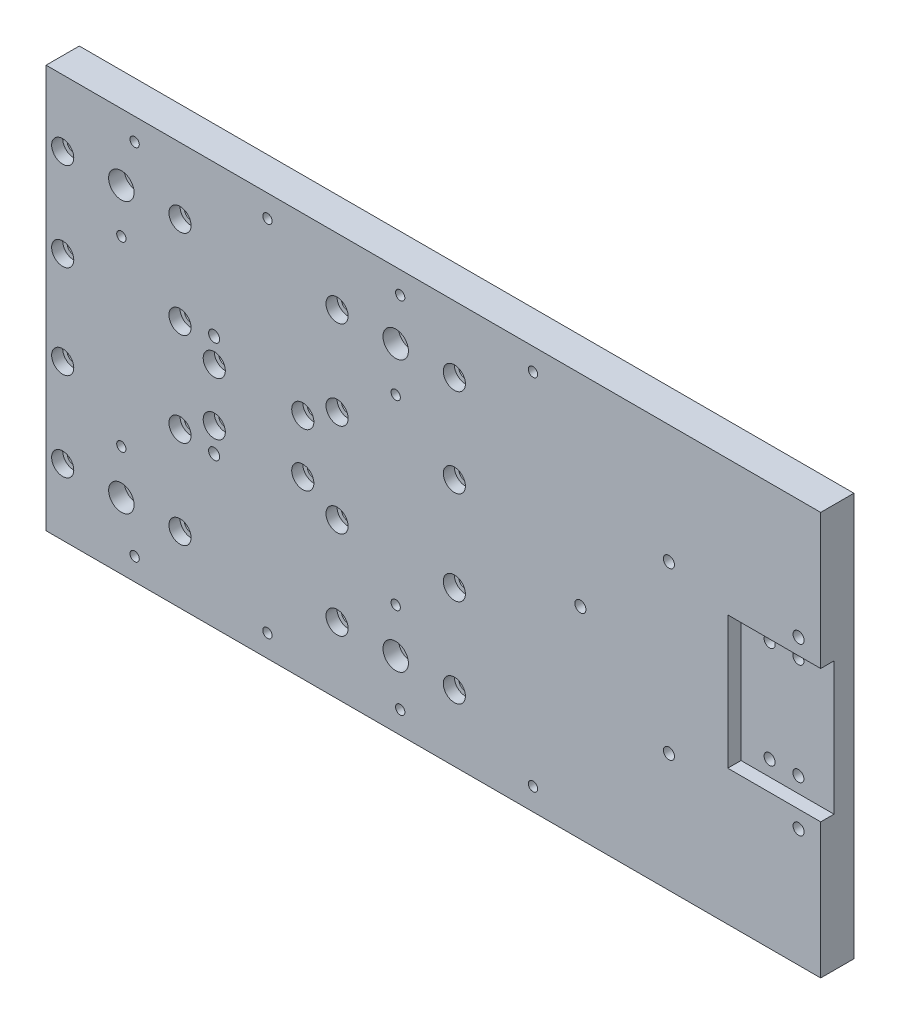
from build123d import *

# Parameters (mm, degrees)
SKETCH1_W                        = 350
SKETCH1_H                        = 132.2
SKETCH1_H_2                      = 25
BOSS_EXTRUDE1_DEPTH              = 15
CARRIAGEHOLES_D                  = 6
CARRIAGEHOLES_CBORE_D            = 10
CARRIAGEHOLES_CBORE_DEPTH        = 5
CARRIAGESETSCREWS_D              = 4.2
BOTTOMRAILHOLES_D                = 4.2
SKETCH10_W                       = 60
SKETCH10_H                       = 50
SKETCH10_H_2                     = 15
CUT_EXTRUDE1_DEPTH               = 4
SFUNUTHOLES_D                    = 6
SFUNUTHOLES_DEPTH                = 11
SFUNUTHOLES_CBORE_D              = 10
SFUNUTHOLES_CBORE_DEPTH          = 5
SFUNUTHOLES_TIP                  = 1.802581857
SKETCH13_W                       = 42
SKETCH13_H                       = 60
BKNOTCH_DEPTH                    = 6
M6X1_0_TAPPED_HOLE1_D            = 5
M6X1_0_TAPPED_HOLE1_DEPTH        = 15
M6X1_0_TAPPED_HOLE1_TIP          = 1.502151548
BFBLOCKHOLES_D                   = 5
BFBLOCKHOLES_DEPTH               = 11
SKETCH22_W                       = 60
SKETCH22_H                       = 51.1
CUT_EXTRUDE2_DEPTH               = 4
MOTORMOUNT_D                     = 5
CARRIAGEPLATESSCREWS_D           = 6.6
CARRIAGEPLATESSCREWS_CBORE_D     = 11.5
CARRIAGEPLATESSCREWS_CBORE_DEPTH = 7
M6X1_0_TAPPED_HOLE2_D            = 5


with BuildPart() as part:
    # Sketch1 → Boss-Extrude1 (new body)
    with BuildSketch(Plane.XY):
        with Locations((28.251813468, -4.511813374)):
            Rectangle(SKETCH1_W, SKETCH1_H)
        with Locations((28.251813468, 74.088186626)):
            Rectangle(SKETCH1_W, SKETCH1_H_2)
        with Locations((28.251813468, -83.111813374)):
            Rectangle(SKETCH1_W, SKETCH1_H_2)
    extrude(amount=BOSS_EXTRUDE1_DEPTH)

    # carriageHoles (through all)
    with Locations(Plane(origin=(37.718280998, 56.588186626, 15), x_dir=(1, 0, 0), z_dir=(0, 0, 1))):
        with Locations((0, 0), (0, -40), (-53, -40), (-53, 0), (0, -82.2), (0, -122.2), (-53, -122.2), (-53, -82.2), (-123.96646753, -82.2), (-123.96646753, -122.2), (-176.96646753, -122.2), (-176.96646753, -82.2), (-176.96646753, -40), (-123.96646753, -40), (-123.96646753, 0), (-176.96646753, 0)):
            CounterBoreHole(CARRIAGEHOLES_D / 2, CARRIAGEHOLES_CBORE_D / 2, CARRIAGEHOLES_CBORE_DEPTH)

    # carriageSetScrews (through all)
    with Locations(Plane(origin=(11.218280998, 36.588186626, 15), x_dir=(1, 0, 0), z_dir=(0, 0, 1))):
        with Locations((0, 0), (-123.96646753, -82.2), (-123.96646753, 0), (0, -82.2)):
            Hole(CARRIAGESETSCREWS_D / 2)

    # bottomRailHoles (through all)
    with Locations(Plane(origin=(-106.748186532, 76.569952861, 15), x_dir=(1, 0, 0), z_dir=(0, 0, 1))):
        with Locations((0, 0), (60, 0), (120, 0), (180, 0), (180, -162.16353247), (120, -162.16353247), (60, -162.16353247), (0, -162.16353247)):
            Hole(BOTTOMRAILHOLES_D / 2)

    # Sketch10 → Cut-Extrude1 (cut)
    with BuildSketch(Plane(origin=(0, 0, 0), x_dir=(-1, 0, 0), z_dir=(0, 0, -1))):
        with Locations((50.764952767, -4.511813374)):
            Rectangle(SKETCH10_W, SKETCH10_H)
        with Locations((50.764952767, -37.011813374)):
            Rectangle(SKETCH10_W, SKETCH10_H_2)
    extrude(amount=-CUT_EXTRUDE1_DEPTH, mode=Mode.SUBTRACT)

    # sfuNutHoles
    with Locations(Plane(origin=(-30.764952767, 7.488186626, 15), x_dir=(1, 0, 0), z_dir=(0, 0, 1))):
        with Locations((0, 0), (0, -24), (-40, -24), (-40, 0)):
            CounterBoreHole(SFUNUTHOLES_D / 2, SFUNUTHOLES_CBORE_D / 2, SFUNUTHOLES_CBORE_DEPTH, depth=SFUNUTHOLES_DEPTH)
            with Locations((0, 0, -(SFUNUTHOLES_DEPTH + SFUNUTHOLES_TIP / 2))):  # 118° drill point
                Cone(0, SFUNUTHOLES_D / 2, SFUNUTHOLES_TIP, mode=Mode.SUBTRACT)

    # Sketch13 → bkNotch (cut)
    with BuildSketch(Plane.XY.offset(15)):
        with Locations((182.251813468, -4.511813374)):
            Rectangle(SKETCH13_W, SKETCH13_H)
    extrude(amount=-BKNOTCH_DEPTH, mode=Mode.SUBTRACT)

    # M6x1.0 Tapped Hole1
    with Locations(Plane(origin=(187.161743151, 18.488186626, 9), x_dir=(1, 0, 0), z_dir=(0, 0, 1))):
        with Locations((0, 0), (-13, 0), (0, -46), (-13, -46)):
            Hole(M6X1_0_TAPPED_HOLE1_D / 2, depth=M6X1_0_TAPPED_HOLE1_DEPTH)
            with Locations((0, 0, -(M6X1_0_TAPPED_HOLE1_DEPTH + M6X1_0_TAPPED_HOLE1_TIP / 2))):  # 118° drill point
                Cone(0, M6X1_0_TAPPED_HOLE1_D / 2, M6X1_0_TAPPED_HOLE1_TIP, mode=Mode.SUBTRACT)

    # BFBlockHoles
    with Locations(Plane(origin=(-70.838256849, 18.488186626, 15), x_dir=(1, 0, 0), z_dir=(0, 0, 1))):
        with Locations((0, 0), (0, -46)):
            Hole(BFBLOCKHOLES_D / 2, depth=BFBLOCKHOLES_DEPTH)

    # Sketch22 → Cut-Extrude2 (cut)
    with BuildSketch(Plane(origin=(0, 0, 0), x_dir=(-1, 0, 0), z_dir=(0, 0, -1))):
        with Locations((50.764952767, -70.061813374)):
            Rectangle(SKETCH22_W, SKETCH22_H)
    extrude(amount=-CUT_EXTRUDE2_DEPTH, mode=Mode.SUBTRACT)

    # MotorMount (through all)
    with Locations(Plane(origin=(193.251813468, 32.733794894, 15), x_dir=(1, 0, 0), z_dir=(0, 0, 1))):
        with Locations((0, 0), (0, -74.991216537)):
            Hole(MOTORMOUNT_D / 2)

    # carriagePlatesScrews (through all)
    with Locations(Plane(origin=(11.218280998, 56.588186626, 15), x_dir=(1, 0, 0), z_dir=(0, 0, 1))):
        with Locations((0, 0), (0, -122.2), (-123.96646753, -122.2), (-123.96646753, 0)):
            CounterBoreHole(CARRIAGEPLATESSCREWS_D / 2, CARRIAGEPLATESSCREWS_CBORE_D / 2, CARRIAGEPLATESSCREWS_CBORE_DEPTH)

    # M6x1.0 Tapped Hole2 (through all)
    with Locations(Plane(origin=(134.678280998, -42.011813374, 0), x_dir=(-1, 0, 0), z_dir=(0, 0, -1))):
        with Locations((0, 0), (40, 37.5), (0, 75)):
            Hole(M6X1_0_TAPPED_HOLE2_D / 2)


solid = part.part
